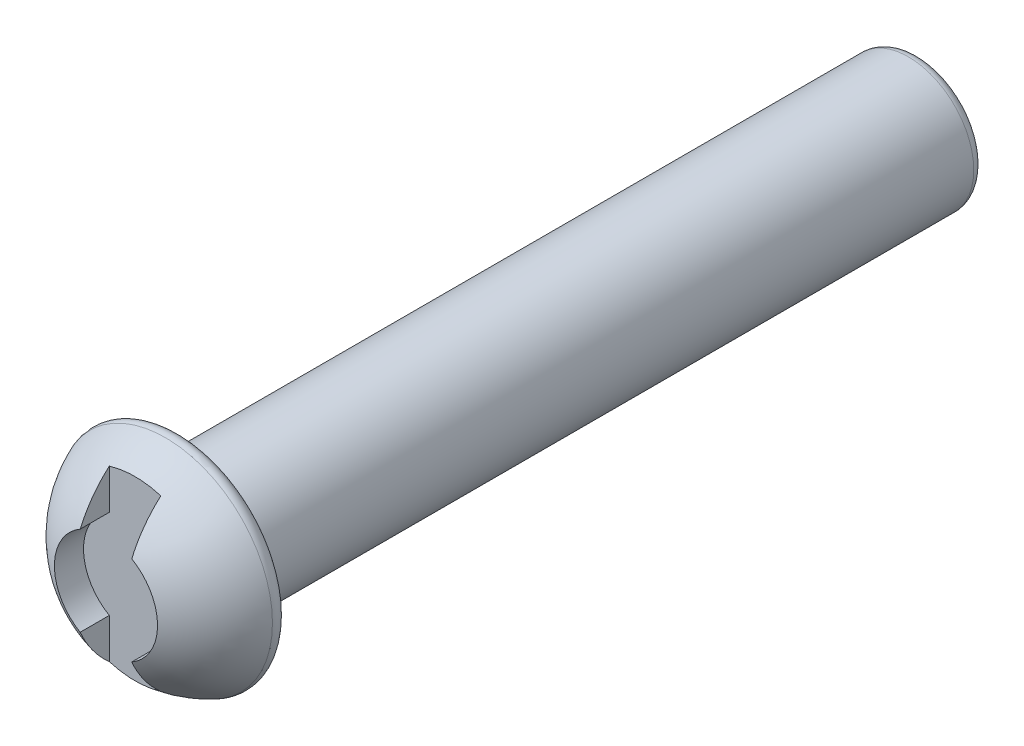
from build123d import *

# Parameters (mm, degrees)
CUT_EXTRUDE1_DEPTH = 0.6
FILLET1_R          = 0.15


with BuildPart() as part:
    # Sketch1 → Revolve1 (revolve)
    with BuildSketch(Plane(origin=(0, 0, 0), x_dir=(0, 0, -1), z_dir=(1, 0, 0))):
        with BuildLine():
            Line((0, 0), (12, 0))
            Line((12, 0), (12, 0.95))
            Line((12, 0.95), (1.25, 0.95))
            Line((1.25, 0.95), (1.25, 1.625))
            ThreePointArc((1.25, 1.625), (0.348650918, 1.025076217), (0, 0))
        make_face()
    revolve(axis=Axis((0, 0, 0), (0, 0, -1)))

    # Sketch2 → Cut-Extrude1 (cut)
    with BuildSketch(Plane.XY):
        with BuildLine():
            Line((0.375, -0.649519053), (0.375, -1.910304893))
            Line((0.375, -1.910304893), (-0.375, -1.910304893))
            Line((-0.375, -1.910304893), (-0.375, -0.649519053))
            ThreePointArc((-0.375, -0.649519053), (-0.75, 0), (-0.375, 0.649519053))
            Line((-0.375, 0.649519053), (-0.375, 1.910304893))
            Line((-0.375, 1.910304893), (0.375, 1.910304893))
            Line((0.375, 1.910304893), (0.375, 0.649519053))
            ThreePointArc((0.375, 0.649519053), (0.75, 0), (0.375, -0.649519053))
        make_face()
    extrude(amount=-CUT_EXTRUDE1_DEPTH, mode=Mode.SUBTRACT)

    # Fillet1
    fillet1_edges = [part.edges().sort_by_distance(p)[0] for p in [
        (0, -1.625, -1.25),
        (0, -0.95, -12),
    ]]
    fillet(fillet1_edges, radius=FILLET1_R)


solid = part.part
